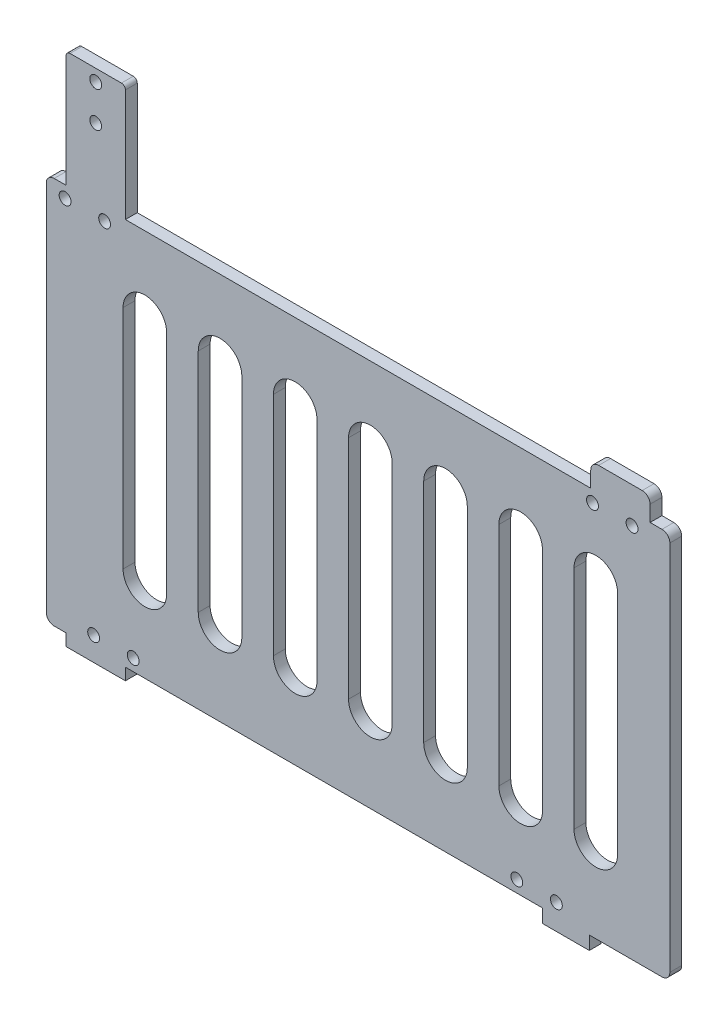
from build123d import *

# Parameters (mm, degrees)
EXTRUDE_1_DEPTH      = 3
SKETCH_2_W           = 15
SKETCH_2_H           = 3
EXTRUDE_2_DEPTH      = 0.5
FILLET_4_R           = 0.5
SKETCH_6_W           = 118.474287265
SKETCH_6_H           = 3
CUT_EXTRUDE_3_DEPTH  = 10
SKETCH_10_R          = 1.5
CUT_EXTRUDE_7_DEPTH  = 191.555825154
SKETCH_11_R          = 1.5
CUT_EXTRUDE_8_DEPTH  = 191.555825154
SKETCH_15_W          = 15
SKETCH_15_H          = 9
EXTRUDE_4_DEPTH      = 3
FILLET_7_R           = 1
SKETCH_16_R          = 1.5
CUT_EXTRUDE_9_DEPTH  = 194.047828552
EXTRUDE_5_DEPTH      = 3
CUT_EXTRUDE_10_DEPTH = 10
FILLET_8_R           = 2
SKETCH_19_W          = 19.175712735
SKETCH_19_H          = 3
CUT_EXTRUDE_11_DEPTH = 10
FILLET_9_R           = 2
SKETCH_20_W          = 11.767330379
SKETCH_20_H          = 3.399854124
EXTRUDE_6_DEPTH      = 3
SKETCH_21_R          = 1.5
CUT_EXTRUDE_12_DEPTH = 10
SKETCH_23_R          = 1.5
CUT_EXTRUDE_13_DEPTH = 10


with BuildPart() as part:
    # 草图1 → 凸台-拉伸1 (new body)
    with BuildSketch(Plane.XY):
        Polygon((0, 101), (0, 0), (157.65, 0), (157.65, 101), (152.65, 101), (152.65, 107), (137.65, 107), (137.65, 101), (20, 101), (20, 104), (5, 104), (5, 101), align=None)
    extrude(amount=EXTRUDE_1_DEPTH)

    # 草图2 → 凸台-拉伸2 (add)
    with BuildSketch(Plane(origin=(0, 104, 0), x_dir=(1, 0, 0), z_dir=(0, 1, 0))):
        with Locations((12.5, -1.5)):
            Rectangle(SKETCH_2_W, SKETCH_2_H)
    extrude(amount=EXTRUDE_2_DEPTH)

    # 圆角4
    fillet_4_edges = [part.edges().sort_by_distance(p)[0] for p in [
        (0, 0, 1.5),
    ]]
    fillet(fillet_4_edges, radius=FILLET_4_R)

    # 草图6 → 切除-拉伸3 (cut)
    with BuildSketch(Plane.XY.offset(3)):
        with BuildLine():
            Line((5, 3), (0, 3))
            Line((0, 3), (0, 0.5))
            ThreePointArc((0, 0.5), (0.146446609, 0.146446609), (0.5, 0))
            Line((0.5, 0), (5, 0))
            Line((5, 0), (5, 3))
        make_face()
        with Locations((79.237143633, 1.5)):
            Rectangle(SKETCH_6_W, SKETCH_6_H)
    extrude(amount=-CUT_EXTRUDE_3_DEPTH, mode=Mode.SUBTRACT)

    # 草图10 → 切除-拉伸7 (cut, through all)
    with BuildSketch(Plane(origin=(0, 0, 0), x_dir=(-1, 0, 0), z_dir=(0, 0, -1))):
        with Locations((-21.970523915, 6)):
            Circle(SKETCH_10_R)
        with Locations((-11.970523915, 6)):
            Circle(SKETCH_10_R)
    extrude(amount=-CUT_EXTRUDE_7_DEPTH, mode=Mode.SUBTRACT)

    # 草图11 → 切除-拉伸8 (cut, through all)
    with BuildSketch(Plane(origin=(0, 0, 0), x_dir=(-1, 0, 0), z_dir=(0, 0, -1))):
        with Locations((-128.958696033, 6)):
            Circle(SKETCH_11_R)
        with Locations((-118.958696033, 6)):
            Circle(SKETCH_11_R)
    extrude(amount=-CUT_EXTRUDE_8_DEPTH, mode=Mode.SUBTRACT)

    # 草图15 → 凸台-拉伸4 (add)
    with BuildSketch(Plane(origin=(0, 0, 0), x_dir=(-1, 0, 0), z_dir=(0, 0, -1))):
        with Locations((-12.5, 106.877473525)):
            Rectangle(SKETCH_15_W, SKETCH_15_H)
    extrude(amount=-EXTRUDE_4_DEPTH)

    # 圆角7
    fillet_7_edges = [part.edges().sort_by_distance(p)[0] for p in [
        (5, 111.377473525, 1.5),
        (20, 111.377473525, 1.5),
    ]]
    fillet(fillet_7_edges, radius=FILLET_7_R)

    # 草图16 → 切除-拉伸9 (cut, through all)
    with BuildSketch(Plane.XY.offset(3)):
        with Locations((4.752930025, 98)):
            Circle(SKETCH_16_R)
        with Locations((14.752930025, 98)):
            Circle(SKETCH_16_R)
    extrude(amount=-CUT_EXTRUDE_9_DEPTH, mode=Mode.SUBTRACT)

    # 草图17 → 凸台-拉伸5 (add)
    with BuildSketch(Plane.XY.offset(3)):
        with BuildLine():
            Line((19, 130.377473525), (6, 130.377473525))
            ThreePointArc((6, 130.377473525), (5.292893219, 130.084580306), (5, 129.377473525))
            Line((5, 129.377473525), (5, 110.377473525))
            Line((5, 110.377473525), (20, 110.377473525))
            Line((20, 110.377473525), (20, 129.377473525))
            ThreePointArc((20, 129.377473525), (19.707106781, 130.084580306), (19, 130.377473525))
        make_face()
    extrude(amount=-EXTRUDE_5_DEPTH)

    # 草图18 → 切除-拉伸10 (cut)
    with BuildSketch(Plane(origin=(0, 0, 0), x_dir=(-1, 0, 0), z_dir=(0, 0, -1))):
        with BuildLine():
            Line((-133.418834054, 81.437570997), (-133.418834054, 24.201192967))
            ThreePointArc((-133.418834054, 24.201192967), (-138.928819365, 18.691207656), (-144.438804677, 24.201192967))
            Line((-144.438804677, 24.201192967), (-144.438804677, 81.437570997))
            ThreePointArc((-144.438804677, 81.437570997), (-138.928819365, 86.947556308), (-133.418834054, 81.437570997))
        make_face()
        with BuildLine():
            Line((-114.418834054, 81.437570997), (-114.418834054, 24.201192967))
            ThreePointArc((-114.418834054, 24.201192967), (-119.928819365, 18.691207656), (-125.438804677, 24.201192967))
            Line((-125.438804677, 24.201192967), (-125.438804677, 81.437570997))
            ThreePointArc((-125.438804677, 81.437570997), (-119.928819365, 86.947556308), (-114.418834054, 81.437570997))
        make_face()
        with BuildLine():
            Line((-95.418834054, 81.437570997), (-95.418834054, 24.201192967))
            ThreePointArc((-95.418834054, 24.201192967), (-100.928819365, 18.691207656), (-106.438804677, 24.201192967))
            Line((-106.438804677, 24.201192967), (-106.438804677, 81.437570997))
            ThreePointArc((-106.438804677, 81.437570997), (-100.928819365, 86.947556308), (-95.418834054, 81.437570997))
        make_face()
        with BuildLine():
            Line((-76.418834054, 81.437570997), (-76.418834054, 24.201192967))
            ThreePointArc((-76.418834054, 24.201192967), (-81.928819365, 18.691207656), (-87.438804677, 24.201192967))
            Line((-87.438804677, 24.201192967), (-87.438804677, 81.437570997))
            ThreePointArc((-87.438804677, 81.437570997), (-81.928819365, 86.947556308), (-76.418834054, 81.437570997))
        make_face()
        with BuildLine():
            Line((-57.418834054, 81.437570997), (-57.418834054, 24.201192967))
            ThreePointArc((-57.418834054, 24.201192967), (-62.928819365, 18.691207656), (-68.438804677, 24.201192967))
            Line((-68.438804677, 24.201192967), (-68.438804677, 81.437570997))
            ThreePointArc((-68.438804677, 81.437570997), (-62.928819365, 86.947556308), (-57.418834054, 81.437570997))
        make_face()
        with BuildLine():
            Line((-38.418834054, 81.437570997), (-38.418834054, 24.201192967))
            ThreePointArc((-38.418834054, 24.201192967), (-43.928819365, 18.691207656), (-49.438804677, 24.201192967))
            Line((-49.438804677, 24.201192967), (-49.438804677, 81.437570997))
            ThreePointArc((-49.438804677, 81.437570997), (-43.928819365, 86.947556308), (-38.418834054, 81.437570997))
        make_face()
        with BuildLine():
            Line((-19.418834054, 81.437570997), (-19.418834054, 24.201192967))
            ThreePointArc((-19.418834054, 24.201192967), (-24.928819365, 18.691207656), (-30.438804677, 24.201192967))
            Line((-30.438804677, 24.201192967), (-30.438804677, 81.437570997))
            ThreePointArc((-30.438804677, 81.437570997), (-24.928819365, 86.947556308), (-19.418834054, 81.437570997))
        make_face()
    extrude(amount=-CUT_EXTRUDE_10_DEPTH, mode=Mode.SUBTRACT)

    # 圆角8
    fillet_8_edges = [part.edges().sort_by_distance(p)[0] for p in [
        (157.65, 101, 1.5),
        (0, 101, 1.5),
        (137.65, 107, 1.5),
        (152.65, 107, 1.5),
        (0, 3, 1.5),
    ]]
    fillet(fillet_8_edges, radius=FILLET_8_R)

    # 草图19 → 切除-拉伸11 (cut)
    with BuildSketch(Plane.XY.offset(3)):
        with Locations((148.062143633, 1.5)):
            Rectangle(SKETCH_19_W, SKETCH_19_H)
    extrude(amount=-CUT_EXTRUDE_11_DEPTH, mode=Mode.SUBTRACT)

    # 圆角9
    fillet_9_edges = [part.edges().sort_by_distance(p)[0] for p in [
        (157.65, 3, 1.5),
    ]]
    fillet(fillet_9_edges, radius=FILLET_9_R)

    # 草图20 → 凸台-拉伸6 (add)
    with BuildSketch(Plane.XY.offset(3)):
        with Locations((131.393642897, 1.300072938)):
            Rectangle(SKETCH_20_W, SKETCH_20_H)
    extrude(amount=-EXTRUDE_6_DEPTH)

    # 草图21 → 切除-拉伸12 (cut)
    with BuildSketch(Plane(origin=(0, 0, 0), x_dir=(-1, 0, 0), z_dir=(0, 0, -1))):
        with Locations((-12.5, 127.377473525)):
            Circle(SKETCH_21_R)
        with Locations((-12.5, 118.377473525)):
            Circle(SKETCH_21_R)
    extrude(amount=-CUT_EXTRUDE_12_DEPTH, mode=Mode.SUBTRACT)

    # 草图23 → 切除-拉伸13 (cut)
    with BuildSketch(Plane.XY.offset(3)):
        with Locations((148.09274498, 98)):
            Circle(SKETCH_23_R)
        with Locations((138.09274498, 98)):
            Circle(SKETCH_23_R)
    extrude(amount=-CUT_EXTRUDE_13_DEPTH, mode=Mode.SUBTRACT)


solid = part.part
